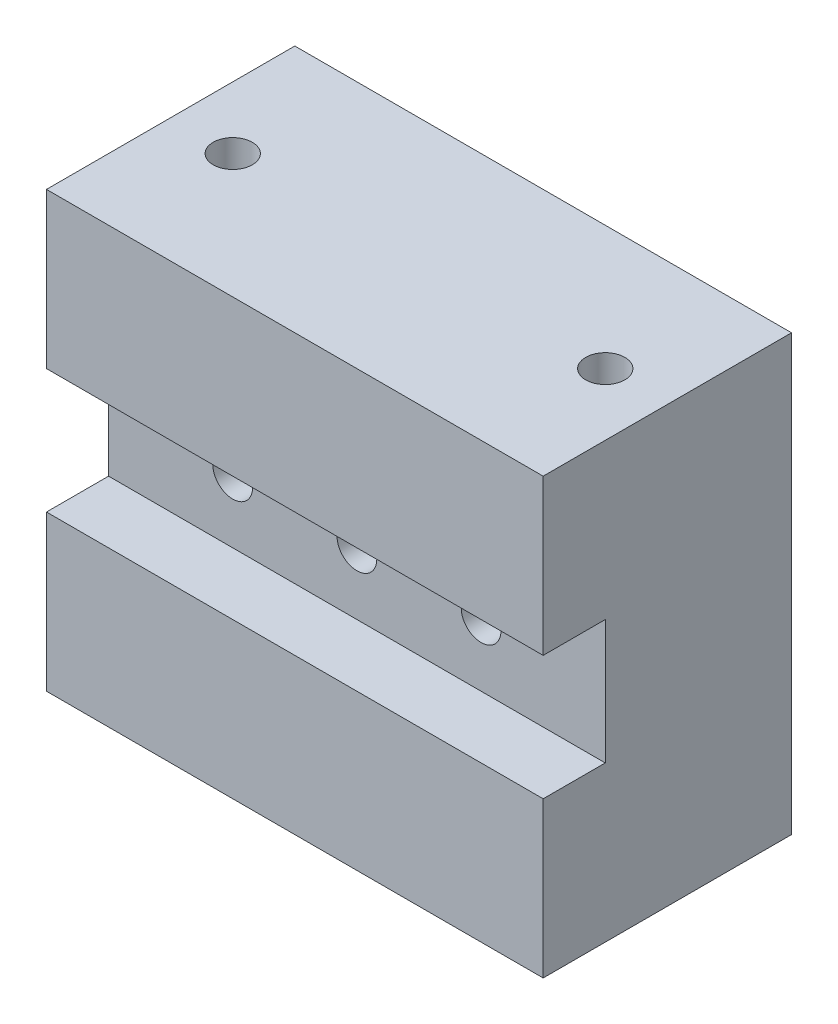
from build123d import *

# Parameters (mm, degrees)
SKETCH1_W           = 50.8
SKETCH1_H           = 44.45
BOSS_EXTRUDE1_DEPTH = 25.4
SKETCH4_R           = 2
CUT_EXTRUDE3_DEPTH  = 73.122135992
SKETCH5_W           = 50.8
SKETCH5_H           = 12.7
CUT_EXTRUDE4_DEPTH  = 6.35
SKETCH6_R           = 2.032
CUT_EXTRUDE5_DEPTH  = 71.138042459


with BuildPart() as part:
    # Sketch1 → Boss-Extrude1 (new body)
    with BuildSketch(Plane.XY):
        with Locations((25.4, 22.225)):
            Rectangle(SKETCH1_W, SKETCH1_H)
    extrude(amount=BOSS_EXTRUDE1_DEPTH)

    # Sketch4 → Cut-Extrude3 (cut, through all)
    with BuildSketch(Plane(origin=(0, 44.45, 0), x_dir=(1, 0, 0), z_dir=(0, 1, 0))):
        with Locations(Location((6.35, -12.7, 0), (0, 0, 270))):
            Circle(SKETCH4_R)
        with Locations(Location((44.45, -12.7, 0), (0, 0, 270))):
            Circle(SKETCH4_R)
    extrude(amount=-CUT_EXTRUDE3_DEPTH, mode=Mode.SUBTRACT)

    # Sketch5 → Cut-Extrude4 (cut)
    with BuildSketch(Plane.XY.offset(25.4)):
        with Locations((25.4, 22.225)):
            Rectangle(SKETCH5_W, SKETCH5_H)
    extrude(amount=-CUT_EXTRUDE4_DEPTH, mode=Mode.SUBTRACT)

    # Sketch6 → Cut-Extrude5 (cut, through all)
    with BuildSketch(Plane.XY.offset(19.05)):
        with Locations((25.4, 22.225)):
            Circle(SKETCH6_R)
        with Locations((38.1, 22.225)):
            Circle(SKETCH6_R)
        with Locations((12.7, 22.225)):
            Circle(SKETCH6_R)
    extrude(amount=-CUT_EXTRUDE5_DEPTH, mode=Mode.SUBTRACT)


solid = part.part
